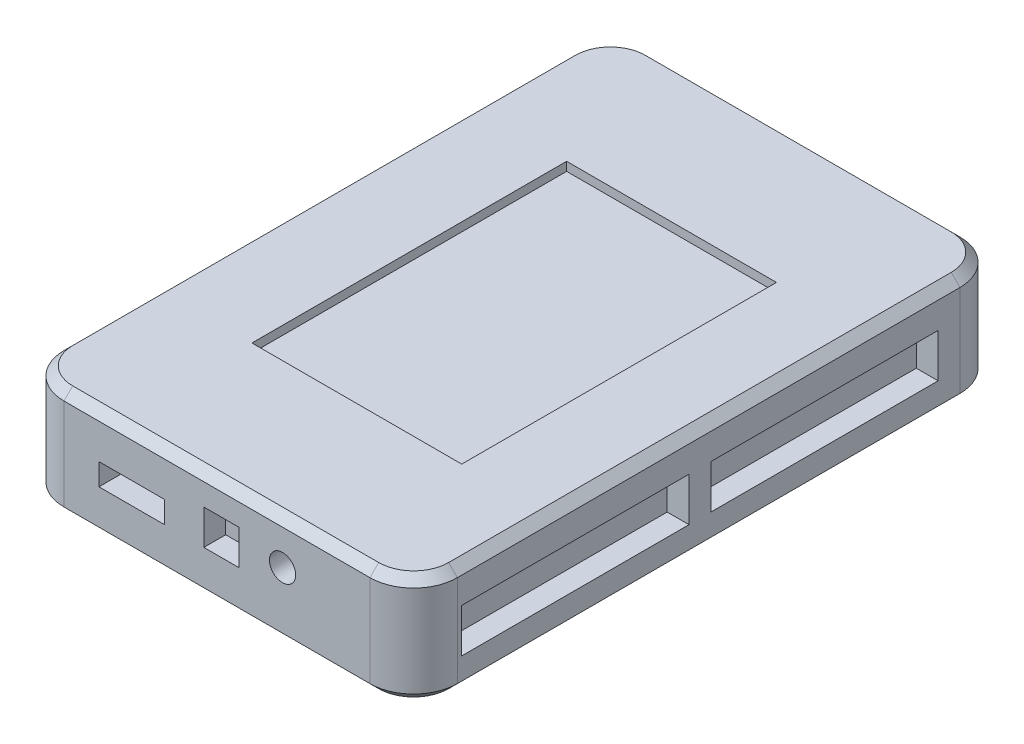
from build123d import *

# Parameters (mm, degrees)
ESQUISSE1_W             = 90
ESQUISSE1_H             = 135
BOSS_EXTRU_1_DEPTH      = 25
CONG_1_R                = 10
CONG_2_R                = 10
CONG_3_R                = 10
CONG_4_R                = 10
CHANFREIN1_SIZE         = 2
CHANFREIN2_SIZE         = 2
ESQUISSE2_R             = 3
ESQUISSE2_W             = 8
ESQUISSE2_H             = 8
ESQUISSE2_W_2           = 15
ESQUISSE2_H_2           = 5
ENL_V_MAT_EXTRU_1_DEPTH = 5
ESQUISSE3_R             = 2
ESQUISSE3_W             = 75
ESQUISSE3_H             = 8
ENL_V_MAT_EXTRU_2_DEPTH = 5
ESQUISSE4_W             = 48
ESQUISSE4_H             = 72
ENL_V_MAT_EXTRU_3_DEPTH = 2
ENL_V_MAT_EXTRU_4_DEPTH = 2
ESQUISSE6_R             = 1.5
BOSS_EXTRU_2_DEPTH      = 2
ESQUISSE7_W             = 52
ESQUISSE7_H             = 10
ENL_V_MAT_EXTRU_5_DEPTH = 5


with BuildPart() as part:
    # Esquisse1 → Boss.-Extru.1 (new body)
    with BuildSketch(Plane(origin=(0, 0, 0), x_dir=(1, 0, 0), z_dir=(0, 1, 0))):
        with Locations((45, 67.5)):
            Rectangle(ESQUISSE1_W, ESQUISSE1_H)
    extrude(amount=BOSS_EXTRU_1_DEPTH)

    # Congé1
    cong_1_edges = [part.edges().sort_by_distance(p)[0] for p in [
        (90, 12.5, 0),
    ]]
    fillet(cong_1_edges, radius=CONG_1_R)

    # Congé2
    cong_2_edges = [part.edges().sort_by_distance(p)[0] for p in [
        (90, 12.5, -135),
    ]]
    fillet(cong_2_edges, radius=CONG_2_R)

    # Congé3
    cong_3_edges = [part.edges().sort_by_distance(p)[0] for p in [
        (0, 12.5, -135),
    ]]
    fillet(cong_3_edges, radius=CONG_3_R)

    # Congé4
    cong_4_edges = [part.edges().sort_by_distance(p)[0] for p in [
        (0, 12.5, 0),
    ]]
    fillet(cong_4_edges, radius=CONG_4_R)

    # Chanfrein1
    chanfrein1_edges = [part.edges().sort_by_distance(p)[0] for p in [
        (90, 25, -67.5),
        (87.071067812, 25, -2.928932188),
        (87.071067812, 25, -132.071067812),
        (45, 25, -135),
        (2.928932188, 25, -132.071067812),
        (45, 25, 0),
        (0, 25, -67.5),
        (2.928932188, 25, -2.928932188),
    ]]
    chamfer(chanfrein1_edges, length=CHANFREIN1_SIZE)

    # Chanfrein2
    chanfrein2_edges = [part.edges().sort_by_distance(p)[0] for p in [
        (90, 0, -67.5),
        (87.071067812, 0, -2.928932188),
        (87.071067812, 0, -132.071067812),
        (45, 0, -135),
        (2.928932188, 0, -132.071067812),
        (45, 0, 0),
        (0, 0, -67.5),
        (2.928932188, 0, -2.928932188),
    ]]
    chamfer(chanfrein2_edges, length=CHANFREIN2_SIZE)

    # Esquisse2 → Enlèv. mat.-Extru.1 (cut)
    with BuildSketch(Plane.XY):
        with Locations((60, 15)):
            Circle(ESQUISSE2_R)
        with Locations((46, 14)):
            Rectangle(ESQUISSE2_W, ESQUISSE2_H)
        with Locations((25.5, 12.5)):
            Rectangle(ESQUISSE2_W_2, ESQUISSE2_H_2)
    extrude(amount=-ENL_V_MAT_EXTRU_1_DEPTH, mode=Mode.SUBTRACT)

    # Esquisse3 → Enlèv. mat.-Extru.2 (cut)
    with BuildSketch(Plane.ZY):
        with Locations((-112, 17)):
            Circle(ESQUISSE3_R)
        with Locations((-100, 17)):
            Circle(ESQUISSE3_R)
        with Locations((-52.5, 13)):
            Rectangle(ESQUISSE3_W, ESQUISSE3_H)
    extrude(amount=-ENL_V_MAT_EXTRU_2_DEPTH, mode=Mode.SUBTRACT)

    # Esquisse4 → Enlèv. mat.-Extru.3 (cut)
    with BuildSketch(Plane(origin=(0, 25, 0), x_dir=(1, 0, 0), z_dir=(0, 1, 0))):
        with Locations((46, 67)):
            Rectangle(ESQUISSE4_W, ESQUISSE4_H)
    extrude(amount=-ENL_V_MAT_EXTRU_3_DEPTH, mode=Mode.SUBTRACT)

    # Esquisse5 → Enlèv. mat.-Extru.4 (cut)
    with BuildSketch(Plane(origin=(0, 0, -135), x_dir=(-1, 0, 0), z_dir=(0, 0, -1))):
        with BuildLine():
            Line((-30, 20), (-20, 20))
            ThreePointArc((-20, 20), (-15, 15), (-20, 10))
            Line((-20, 10), (-30, 10))
            ThreePointArc((-30, 10), (-35, 15), (-30, 20))
        make_face()
    extrude(amount=-ENL_V_MAT_EXTRU_4_DEPTH, mode=Mode.SUBTRACT)

    # Esquisse6 → Boss.-Extru.2 (add)
    with BuildSketch(Plane(origin=(0, 0, -133), x_dir=(-1, 0, 0), z_dir=(0, 0, -1))):
        with Locations(Location((-30, 15, 0), (0, 0, 180))):
            Circle(ESQUISSE6_R)
        with Locations(Location((-20, 15, 0), (0, 0, 180))):
            Circle(ESQUISSE6_R)
    extrude(amount=BOSS_EXTRU_2_DEPTH)

    # Esquisse7 → Enlèv. mat.-Extru.5 (cut)
    with BuildSketch(Plane(origin=(90, 0, 0), x_dir=(0, 0, -1), z_dir=(1, 0, 0))):
        with Locations((37, 12)):
            Rectangle(ESQUISSE7_W, ESQUISSE7_H)
        with Locations((94, 12)):
            Rectangle(ESQUISSE7_W, ESQUISSE7_H)
    extrude(amount=-ENL_V_MAT_EXTRU_5_DEPTH, mode=Mode.SUBTRACT)


solid = part.part
